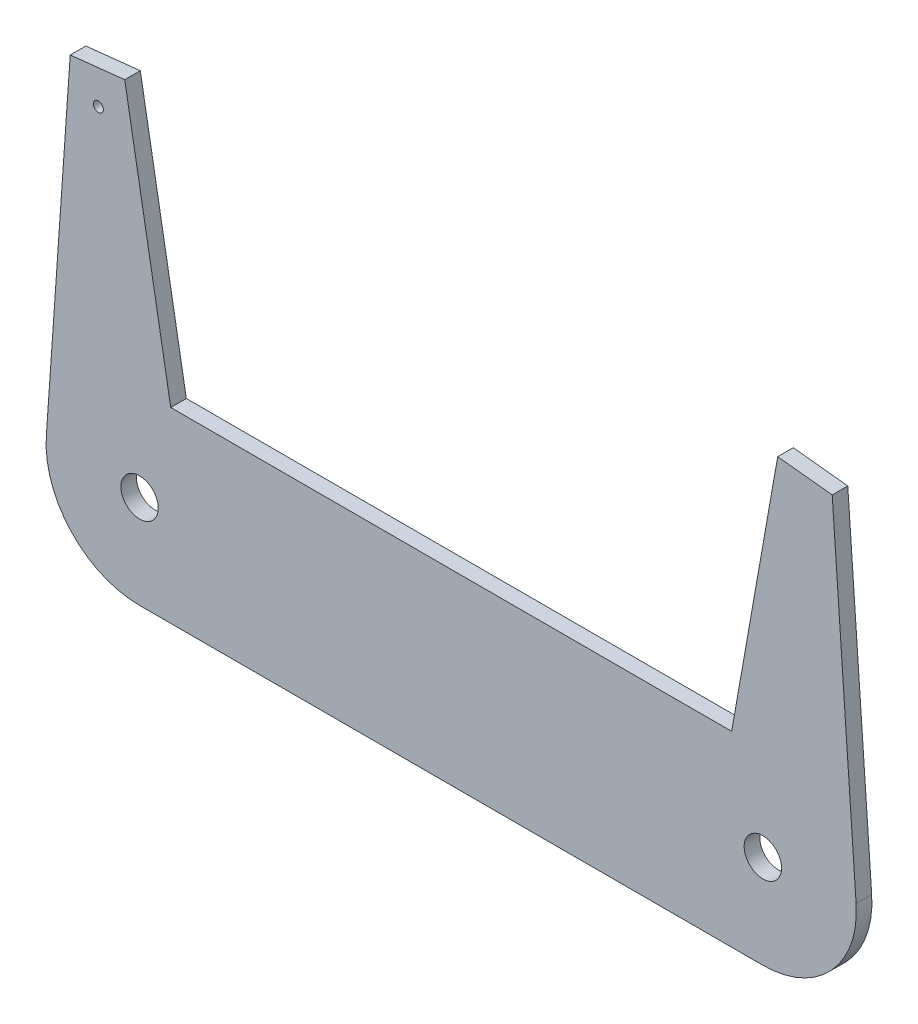
from build123d import *

# Parameters (mm, degrees)
SKETCH1_R           = 1.6
SKETCH1_R_2         = 6
BOSS_EXTRUDE1_DEPTH = 5


with BuildPart() as part:
    # Sketch1 → Boss-Extrude1 (new body)
    with BuildSketch(Plane.XY):
        with BuildLine():
            Line((90, 30), (-90, 30))
            Line((-90, 30), (-104.760095102, 113.708659006))
            Line((-104.760095102, 113.708659006), (-122.253709396, 111.824739741))
            Line((-122.253709396, 111.824739741), (-129.926921508, 2.092694212))
            ThreePointArc((-129.926921508, 2.092694212), (-121.940611049, -20.459950802), (-100, -30))
            Line((-100, -30), (100, -30))
            ThreePointArc((100, -30), (121.940611049, -20.459950802), (129.926921508, 2.092694212))
            Line((129.926921508, 2.092694212), (122.253709396, 111.824739741))
            Line((122.253709396, 111.824739741), (104.760095102, 113.708659006))
            Line((104.760095102, 113.708659006), (90, 30))
        make_face()
        with Locations((-113.211659227, 101.998451941)):
            Circle(SKETCH1_R, mode=Mode.SUBTRACT)
        with Locations((-100, 0)):
            Circle(SKETCH1_R_2, mode=Mode.SUBTRACT)
        with Locations((100, 0)):
            Circle(SKETCH1_R_2, mode=Mode.SUBTRACT)
    extrude(amount=BOSS_EXTRUDE1_DEPTH)


solid = part.part
